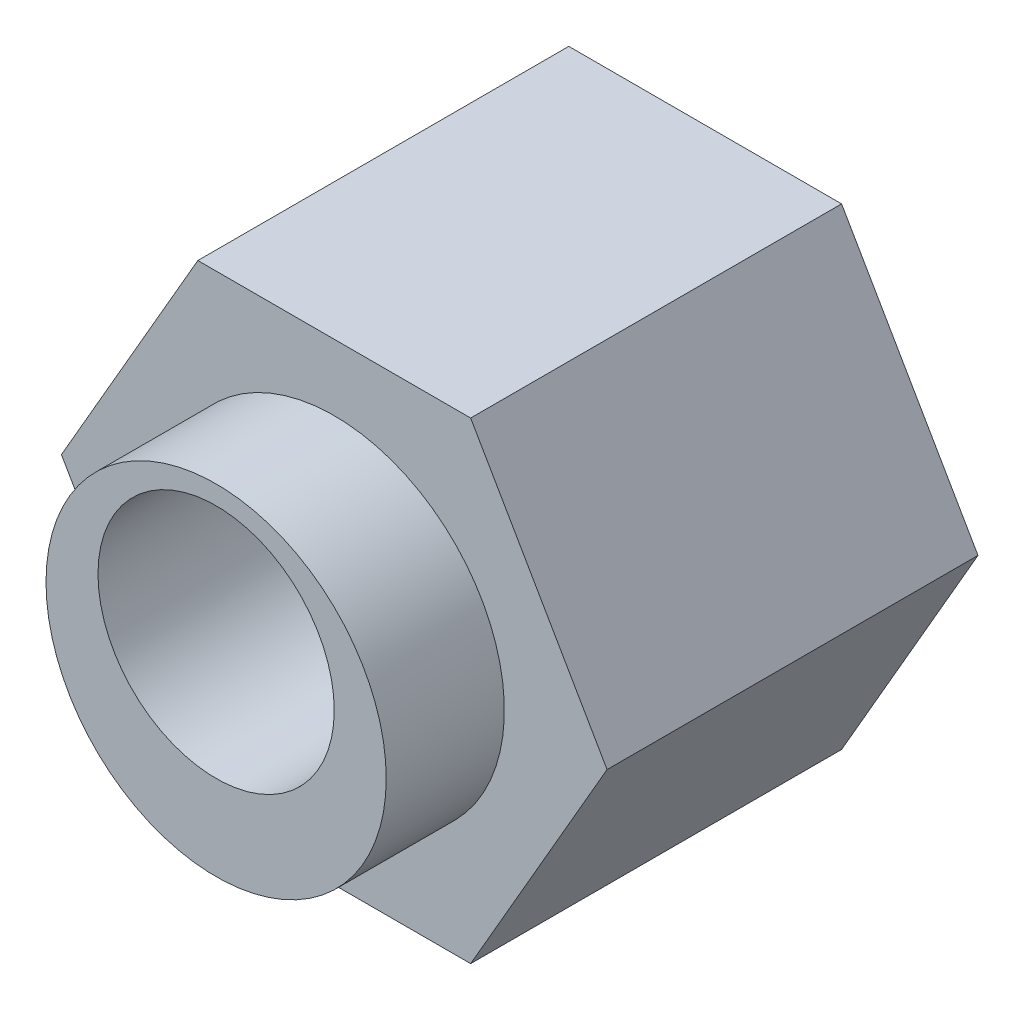
from build123d import *
from build123d.topology import SkipClean

# Parameters (mm, degrees)
SALIENTE_EXTRUIR1_DEPTH = 7.85
CROQUIS6_R              = 3.6
CROQUIS6_R_2            = 2.5
SALIENTE_EXTRUIR2_DEPTH = 2.5
SALIENTE_EXTRUIR3_START = 0.5
CROQUIS7_R              = 3.6
CROQUIS7_R_2            = 2.5
SALIENTE_EXTRUIR3_DEPTH = 0.5
CORTAR_EXTRUIR1_START   = -8.5
CROQUIS9_R              = 2.5
CORTAR_EXTRUIR1_DEPTH   = 8.5


with BuildPart() as part:
    # Croquis1 → Saliente-Extruir1 (new body)
    with BuildSketch(Plane(origin=(0, 0, 0.45), x_dir=(-1, 0, 0), z_dir=(0, 0, -1))):
        Polygon((2.886751346, -5), (5.773502692, 0), (2.886751346, 5), (-2.886751346, 5), (-5.773502692, 0), (-2.886751346, -5), align=None)
    extrude(amount=-SALIENTE_EXTRUIR1_DEPTH)

    # Croquis6 → Saliente-Extruir2 (add)
    with BuildSketch(Plane.XY.offset(8.3)):
        with Locations(Location((0, 0, 0), (0, 0, 180))):
            Circle(CROQUIS6_R)
        with Locations((0, 0.7)):
            Circle(CROQUIS6_R_2, mode=Mode.SUBTRACT)
    extrude(amount=SALIENTE_EXTRUIR2_DEPTH)

    # Croquis7 → Saliente-Extruir3 (add)
    with BuildSketch(Plane(origin=(0, 0, 0.45), x_dir=(-1, 0, 0), z_dir=(0, 0, -1)).offset(SALIENTE_EXTRUIR3_START)):
        Circle(CROQUIS7_R)
        with Locations(Location((0, 0.7, 0), (0, 0, 180))):
            Circle(CROQUIS7_R_2, mode=Mode.SUBTRACT)
    extrude(amount=-SALIENTE_EXTRUIR3_DEPTH)

    # Croquis9 → Cortar-Extruir1 (cut)
    with SkipClean():  # the faces are left unmerged after this step: merging them gives an invalid solid
        with BuildSketch(Plane.XY.offset(8.3).offset(CORTAR_EXTRUIR1_START)):
            with Locations(Location((0, 0.7, 0), (0, 0, 180))):
                Circle(CROQUIS9_R)
        extrude(amount=CORTAR_EXTRUIR1_DEPTH, mode=Mode.SUBTRACT)


solid = part.part
